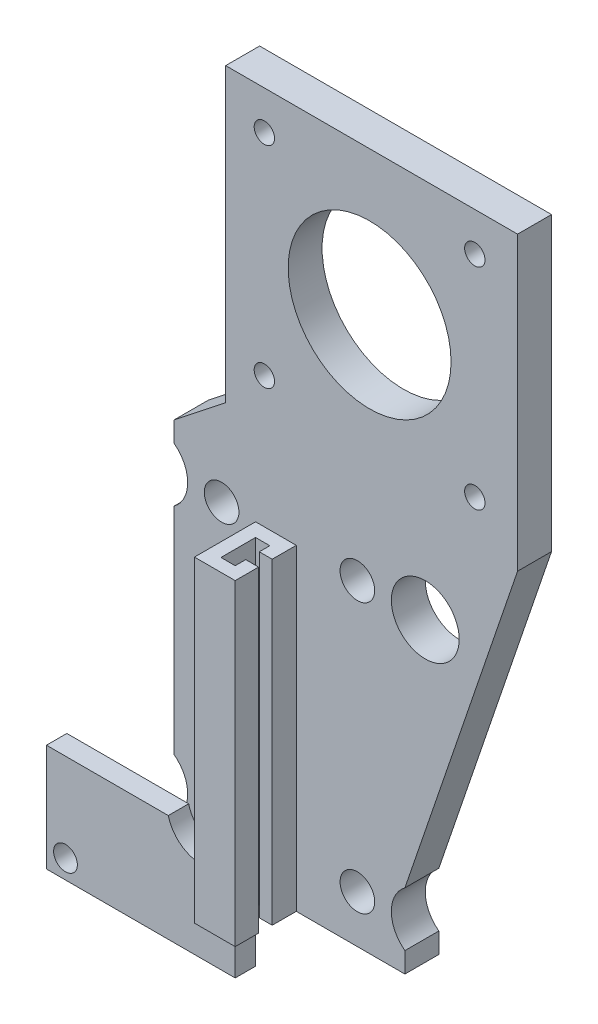
from build123d import *

# Parameters (mm, degrees)
SKETCH1_R               = 2.55
BOSS_EXTRUDE1_DEPTH     = 5
SKETCH2_W               = 6
SKETCH2_H               = 46.7
BOSS_EXTRUDE2_DEPTH     = 9
BOSS_EXTRUDE3_DEPTH     = 3
SKETCH4_R               = 1.75
CUT_EXTRUDE1_DEPTH      = 65.060049953
CUT_EXTRUDE2_DEPTH      = 68.578768855
CUT_EXTRUDE2_DEPTH_BACK = 68.578768855
SKETCH6_W               = 43
SKETCH6_H               = 43
BOSS_EXTRUDE4_DEPTH     = 5
SKETCH8_R               = 1.5
SKETCH8_R_2             = 12
CUT_EXTRUDE3_DEPTH      = 115.841847773
BOSS_EXTRUDE5_START     = -5
BOSS_EXTRUDE5_DEPTH     = 5


with BuildPart() as part:
    # Sketch1 → Boss-Extrude1 (new body)
    with BuildSketch(Plane.XY):
        with BuildLine():
            Line((0, 0), (34, 0))
            Line((34, 0), (34, 3))
            ThreePointArc((34, 3), (32, 7), (34, 11))
            Line((34, 11), (34, 42.7))
            ThreePointArc((34, 42.7), (32, 46.7), (34, 50.7))
            Line((34, 50.7), (34, 53.7))
            Line((34, 53.7), (0, 53.7))
            Line((0, 53.7), (0, 50.7))
            ThreePointArc((0, 50.7), (2, 46.7), (0, 42.7))
            Line((0, 42.7), (0, 11))
            ThreePointArc((0, 11), (2, 7), (0, 3))
            Line((0, 3), (0, 0))
        make_face()
        with Locations((7, 46.7)):
            Circle(SKETCH1_R, mode=Mode.SUBTRACT)
        with Locations((27, 46.7)):
            Circle(SKETCH1_R, mode=Mode.SUBTRACT)
        with Locations((7, 7)):
            Circle(SKETCH1_R, mode=Mode.SUBTRACT)
        with Locations((27, 7)):
            Circle(SKETCH1_R, mode=Mode.SUBTRACT)
    extrude(amount=BOSS_EXTRUDE1_DEPTH)

    # Sketch2 → Boss-Extrude2 (add)
    with BuildSketch(Plane.XY.offset(5)):
        with Locations((15, 23.35)):
            Rectangle(SKETCH2_W, SKETCH2_H)
    extrude(amount=BOSS_EXTRUDE2_DEPTH)

    # Sketch3 → Boss-Extrude3 (add)
    with BuildSketch(Plane.XY.offset(5)):
        with BuildLine():
            Line((12, -10), (12, 5.8))
            Line((12, 5.8), (11.85386444, 5.8))
            ThreePointArc((11.85386444, 5.8), (7, 2), (2.14613556, 5.8))
            Line((2.14613556, 5.8), (-15.8, 5.8))
            Line((-15.8, 5.8), (-15.8, -10))
            Line((-15.8, -10), (12, -10))
        make_face()
    extrude(amount=BOSS_EXTRUDE3_DEPTH)

    # Sketch4 → Cut-Extrude1 (cut, through all)
    with BuildSketch(Plane.XY.offset(8)):
        with Locations((9.2, 3)):
            Circle(SKETCH4_R)
        with Locations((-13, -7.2)):
            Circle(SKETCH4_R)
    extrude(amount=-CUT_EXTRUDE1_DEPTH, mode=Mode.SUBTRACT)

    # Sketch5 → Cut-Extrude2 (cut, two sides: drawn at the far end of the back side and taken through both)
    with BuildSketch(Plane(origin=(0, 46.7, 0), x_dir=(1, 0, 0), z_dir=(0, 1, 0)).offset(-CUT_EXTRUDE2_DEPTH_BACK)):
        Polygon((98.816452891, -8.55), (18, -8.55), (16.1, -8.55), (16.1, -7), (14, -7), (14, -12.1), (16.1, -12.1), (16.1, -10.55), (18, -10.55), (98.816452891, -10.55), (260.449358672, -10.55), (260.449358672, -8.55), align=None)
    extrude(amount=CUT_EXTRUDE2_DEPTH + CUT_EXTRUDE2_DEPTH_BACK, mode=Mode.SUBTRACT)

    # Sketch6 → Boss-Extrude4 (add, through all)
    with BuildSketch(Plane.XY.offset(5)):
        with Locations((29.1, 81.2)):
            Rectangle(SKETCH6_W, SKETCH6_H)
        Polygon((34, 53.7), (50.6, 59.7), (7.6, 59.7), (0, 53.7), align=None)
    extrude(amount=-BOSS_EXTRUDE4_DEPTH)

    # Sketch8 → Cut-Extrude3 (cut, through all)
    with BuildSketch(Plane.XY.offset(5)):
        with Locations((13.3, 97)):
            Circle(SKETCH8_R)
        with Locations((44.3, 97)):
            Circle(SKETCH8_R)
        with Locations((13.3, 66)):
            Circle(SKETCH8_R)
        with Locations((44.3, 66)):
            Circle(SKETCH8_R)
        with Locations((28.8, 81.5)):
            Circle(SKETCH8_R_2)
    extrude(amount=-CUT_EXTRUDE3_DEPTH, mode=Mode.SUBTRACT)

    # Sketch9 → Boss-Extrude5 (add)
    with BuildSketch(Plane.XY.offset(5).offset(BOSS_EXTRUDE5_START)):
        with BuildLine():
            Line((34, 11), (50.6, 59.7))
            Line((50.6, 59.7), (34, 53.7))
            Line((34, 53.7), (34, 50.7))
            ThreePointArc((34, 50.7), (39.236067977, 51.172135955), (42, 46.7))
            ThreePointArc((42, 46.7), (39.236067977, 42.227864045), (34, 42.7))
            Line((34, 42.7), (34, 11))
        make_face()
    extrude(amount=BOSS_EXTRUDE5_DEPTH)


solid = part.part
